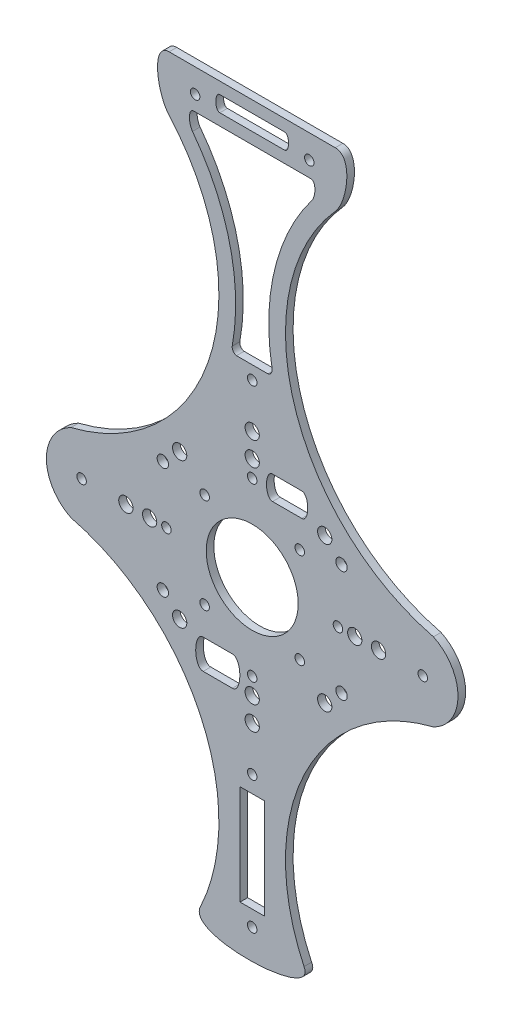
from build123d import *

# Parameters (mm, degrees)
MODEL_R         = 1
MODEL_R_2       = 1.5
MODEL_R_3       = 1.2
MODEL_R_4       = 9.672061212
MODEL_W         = 5.108352415
MODEL_H         = 21
EXTRUDE_1_DEPTH = 1.6


with BuildPart() as part:
    # Model → 凸台-拉伸1 (new body)
    with BuildSketch(Plane.XY):
        with BuildLine():
            Line((164.249855651, 187.088781669), (146.787217515, 187.088781669))
            Line((146.787217515, 187.088781669), (129.32457938, 187.088781669))
            add(Edge.make_bspline(
                [(129.32457938, 187.088781669), (125.461044671, 187.088781669), (126.746381631, 178.375641151), (129.32457938, 175.498177543)],
                knots=[0, 0, 0, 0, 11.590604126, 11.590604126, 11.590604126, 11.590604126], degree=3))
            ThreePointArc((129.32457938, 175.498177543), (139.773420004, 147.014985412), (127.780187237, 119.146851779))
            ThreePointArc((127.780187237, 119.146851779), (118.967335725, 112.447515783), (108.683438965, 108.350087077))
            ThreePointArc((108.683438965, 108.350087077), (103.514701902, 100.139821501), (108.683438965, 91.929555925))
            ThreePointArc((108.683438965, 91.929555925), (118.967335725, 87.832127219), (127.780187237, 81.132791223))
            ThreePointArc((127.780187237, 81.132791223), (139.177354468, 59.195873616), (135.89135677, 34.694322764))
            add(Edge.make_bspline(
                [(135.89135677, 34.694322764), (132.800282497, 28.120921276), (160.774152533, 29.120921276), (157.683078261, 34.694322764)],
                knots=[0, 0, 0, 0, 21.791721492, 21.791721492, 21.791721492, 21.791721492], degree=3))
            ThreePointArc((157.683078261, 34.694322764), (154.397080563, 59.195873616), (165.794247794, 81.132791223))
            ThreePointArc((165.794247794, 81.132791223), (174.607099306, 87.832127219), (184.890996066, 91.929555925))
            ThreePointArc((184.890996066, 91.929555925), (190.059733129, 100.139821501), (184.890996066, 108.350087077))
            ThreePointArc((184.890996066, 108.350087077), (174.607099306, 112.447515783), (165.794247794, 119.146851779))
            ThreePointArc((165.794247794, 119.146851779), (153.801015027, 147.014985412), (164.249855651, 175.498177543))
            add(Edge.make_bspline(
                [(164.249855651, 187.088781669), (168.11339036, 187.088781669), (166.8280534, 178.375641151), (164.249855651, 175.498177543)],
                knots=[0, 0, 0, 0, 11.590604126, 11.590604126, 11.590604126, 11.590604126], degree=3))
        make_face()
        with Locations((156.787217515, 110.139821501)):
            Circle(MODEL_R, mode=Mode.SUBTRACT)
        with Locations((136.787217515, 110.139821501)):
            Circle(MODEL_R, mode=Mode.SUBTRACT)
        with Locations((136.787217515, 90.139821501)):
            Circle(MODEL_R, mode=Mode.SUBTRACT)
        with Locations((156.787217515, 90.139821501)):
            Circle(MODEL_R, mode=Mode.SUBTRACT)
        with Locations((168.353974342, 100.139821501)):
            Circle(MODEL_R_2, mode=Mode.SUBTRACT)
        with Locations((146.787217515, 121.706578327)):
            Circle(MODEL_R_2, mode=Mode.SUBTRACT)
        with Locations((125.220460689, 100.139821501)):
            Circle(MODEL_R_2, mode=Mode.SUBTRACT)
        with Locations((146.787217515, 78.573064675)):
            Circle(MODEL_R_2, mode=Mode.SUBTRACT)
        with Locations((146.787217515, 126.706578327)):
            Circle(MODEL_R_2, mode=Mode.SUBTRACT)
        with Locations((120.220460689, 100.139821501)):
            Circle(MODEL_R_2, mode=Mode.SUBTRACT)
        with Locations((146.787217515, 73.573064675)):
            Circle(MODEL_R_2, mode=Mode.SUBTRACT)
        with Locations((173.353974342, 100.139821501)):
            Circle(MODEL_R_2, mode=Mode.SUBTRACT)
        with Locations((146.787217515, 118.171044401)):
            Circle(MODEL_R, mode=Mode.SUBTRACT)
        with Locations((128.755994615, 100.139821501)):
            Circle(MODEL_R, mode=Mode.SUBTRACT)
        with Locations((146.787217515, 82.108598601)):
            Circle(MODEL_R, mode=Mode.SUBTRACT)
        with Locations((164.818440415, 100.139821501)):
            Circle(MODEL_R, mode=Mode.SUBTRACT)
        with Locations((162.037217515, 115.389821501)):
            Circle(MODEL_R_2, mode=Mode.SUBTRACT)
        with Locations((131.537217515, 115.389821501)):
            Circle(MODEL_R_2, mode=Mode.SUBTRACT)
        with Locations((131.537217515, 84.889821501)):
            Circle(MODEL_R_2, mode=Mode.SUBTRACT)
        with Locations((162.037217515, 84.889821501)):
            Circle(MODEL_R_2, mode=Mode.SUBTRACT)
        with Locations((182.657217515, 100.139821501)):
            Circle(MODEL_R, mode=Mode.SUBTRACT)
        with Locations((146.787217515, 136.036864466)):
            Circle(MODEL_R, mode=Mode.SUBTRACT)
        with Locations((110.917217515, 100.139821501)):
            Circle(MODEL_R, mode=Mode.SUBTRACT)
        with Locations((146.787217515, 64.242778536)):
            Circle(MODEL_R, mode=Mode.SUBTRACT)
        with Locations((146.787217515, 36.419821501)):
            Circle(MODEL_R, mode=Mode.SUBTRACT)
        with Locations((158.787217515, 182.099821501)):
            Circle(MODEL_R, mode=Mode.SUBTRACT)
        with Locations((134.787217515, 182.099821501)):
            Circle(MODEL_R, mode=Mode.SUBTRACT)
        with Locations((128.00168361, 111.854287595)):
            Circle(MODEL_R_3, mode=Mode.SUBTRACT)
        with Locations((165.572751421, 111.854287595)):
            Circle(MODEL_R_3, mode=Mode.SUBTRACT)
        with Locations((128.00168361, 88.425355407)):
            Circle(MODEL_R_3, mode=Mode.SUBTRACT)
        with Locations((165.572751421, 88.425355407)):
            Circle(MODEL_R_3, mode=Mode.SUBTRACT)
        with Locations((146.787217515, 100.139821501)):
            Circle(MODEL_R_4, mode=Mode.SUBTRACT)
        with BuildLine():
            Line((159.067032454, 178.883153661), (146.787217515, 178.883153661))
            Line((146.787217515, 178.883153661), (134.507402577, 178.883153661))
            add(Edge.make_bspline(
                [(134.507402577, 178.883153661), (133.227688428, 178.883153661), (133.453062144, 176.072728685), (134.227836458, 175.05420374)],
                knots=[0, 0, 0, 0, 3.839142445, 3.839142445, 3.839142445, 3.839142445], degree=3))
            ThreePointArc((134.227836458, 175.05420374), (142.088179874, 158.46992126), (142.587324671, 140.123960438))
            add(Edge.make_bspline(
                [(142.587324671, 140.123960438), (142.493407811, 139.609308925), (142.9625841, 138.837088874), (143.485734707, 138.837088874)],
                knots=[0, 0, 0, 0, 1.56945182, 1.56945182, 1.56945182, 1.56945182], degree=3))
            Line((143.485734707, 138.837088874), (146.787217515, 138.837088874))
            Line((146.787217515, 138.837088874), (150.088700324, 138.837088874))
            add(Edge.make_bspline(
                [(150.98711036, 140.123960438), (151.08102722, 139.609308925), (150.611850931, 138.837088874), (150.088700324, 138.837088874)],
                knots=[0, 0, 0, 0, 1.56945182, 1.56945182, 1.56945182, 1.56945182], degree=3))
            ThreePointArc((150.98711036, 140.123960438), (151.486255157, 158.46992126), (159.346598573, 175.05420374))
            add(Edge.make_bspline(
                [(159.067032454, 178.883153661), (160.346746603, 178.883153661), (160.121372887, 176.072728685), (159.346598573, 175.05420374)],
                knots=[0, 0, 0, 0, 3.839142445, 3.839142445, 3.839142445, 3.839142445], degree=3))
        make_face(mode=Mode.SUBTRACT)
        with BuildLine():
            Line((151.053210178, 121.070269245), (157.209188782, 121.070269245))
            add(Edge.make_bspline(
                [(157.209188782, 121.070269245), (158.876955289, 121.070269245), (158.876955289, 116.066969722), (157.209188782, 116.066969722)],
                knots=[0, 0, 0, 0, 5.003299523, 5.003299523, 5.003299523, 5.003299523], degree=3))
            Line((157.209188782, 116.066969722), (151.053210178, 116.066969722))
            add(Edge.make_bspline(
                [(151.053210178, 121.070269245), (149.38544367, 121.070269245), (149.38544367, 116.066969722), (151.053210178, 116.066969722)],
                knots=[0, 0, 0, 0, 5.003299523, 5.003299523, 5.003299523, 5.003299523], degree=3))
        make_face(mode=Mode.SUBTRACT)
        with BuildLine():
            Line((136.47001729, 84.090392193), (142.625995894, 84.090392193))
            add(Edge.make_bspline(
                [(142.625995894, 84.090392193), (144.706817358, 84.090392193), (144.706817358, 77.847927799), (142.625995894, 77.847927799)],
                knots=[0, 0, 0, 0, 6.242464394, 6.242464394, 6.242464394, 6.242464394], degree=3))
            Line((142.625995894, 77.847927799), (136.47001729, 77.847927799))
            add(Edge.make_bspline(
                [(136.47001729, 84.090392193), (134.389195825, 84.090392193), (134.389195825, 77.847927799), (136.47001729, 77.847927799)],
                knots=[0, 0, 0, 0, 6.242464394, 6.242464394, 6.242464394, 6.242464394], degree=3))
        make_face(mode=Mode.SUBTRACT)
        with BuildLine():
            Line((139.974283877, 181.317718414), (153.600151154, 181.317718414))
            add(Edge.make_bspline(
                [(153.600151154, 184.631261375), (154.704665474, 184.631261375), (154.704665474, 181.317718414), (153.600151154, 181.317718414)],
                knots=[0, 0, 0, 0, 3.313542961, 3.313542961, 3.313542961, 3.313542961], degree=3))
            Line((153.600151154, 184.631261375), (139.974283877, 184.631261375))
            add(Edge.make_bspline(
                [(139.974283877, 184.631261375), (138.869769557, 184.631261375), (138.869769557, 181.317718414), (139.974283877, 181.317718414)],
                knots=[0, 0, 0, 0, 3.313542961, 3.313542961, 3.313542961, 3.313542961], degree=3))
        make_face(mode=Mode.SUBTRACT)
        with Locations((146.787217516, 50.217854956)):
            Rectangle(MODEL_W, MODEL_H, mode=Mode.SUBTRACT)
    extrude(amount=EXTRUDE_1_DEPTH)


solid = part.part
